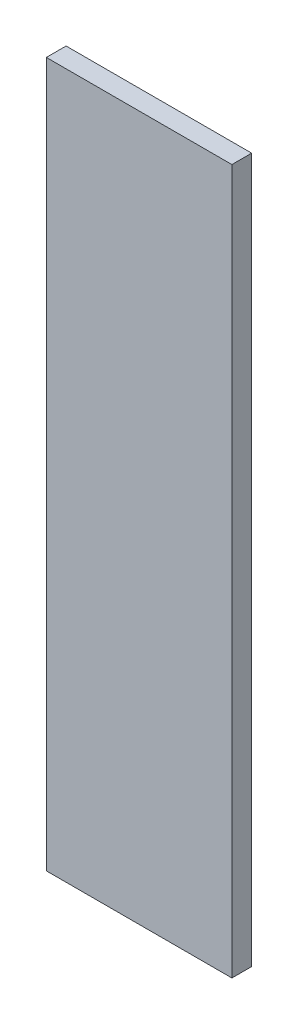
from build123d import *

# Parameters (mm, degrees)
SKETCH1_W           = 41
SKETCH1_H           = 10.8
BOSS_EXTRUDE1_DEPTH = 1.15


with BuildPart() as part:
    # Sketch1 → Boss-Extrude1 (new body)
    with BuildSketch(Plane(origin=(0, 0, 0), x_dir=(0, 1, 0), z_dir=(0, 0, 1))):
        Rectangle(SKETCH1_W, SKETCH1_H)
    extrude(amount=BOSS_EXTRUDE1_DEPTH)


solid = part.part
